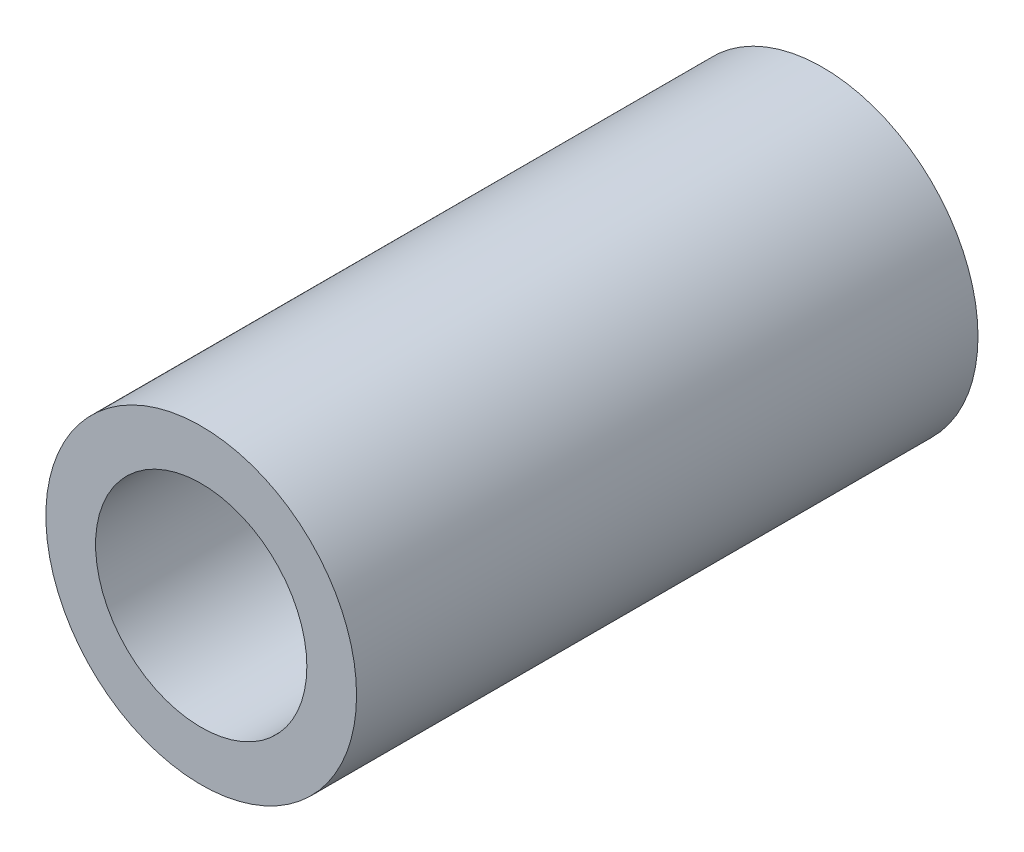
from build123d import *

# Parameters (mm, degrees)
BOSS_EXTRUDE1_DEPTH      = 25
BOSS_EXTRUDE1_DEPTH_BACK = 25
SKETCH1_R                = 12.5
SKETCH2_R                = 8.5
CUT_EXTRUDE1_DEPTH       = 50


with BuildPart() as part:
    # Sketch1 → Boss-Extrude1 (new, two sides: drawn at the far end of the back side and taken through both)
    with BuildSketch(Plane.XY.offset(-BOSS_EXTRUDE1_DEPTH_BACK)):
        Circle(SKETCH1_R)
    extrude(amount=BOSS_EXTRUDE1_DEPTH + BOSS_EXTRUDE1_DEPTH_BACK)

    # Sketch2 → Cut-Extrude1 (cut)
    with BuildSketch(Plane.XY.offset(25)):
        Circle(SKETCH2_R)
    extrude(amount=-CUT_EXTRUDE1_DEPTH, mode=Mode.SUBTRACT)


solid = part.part
